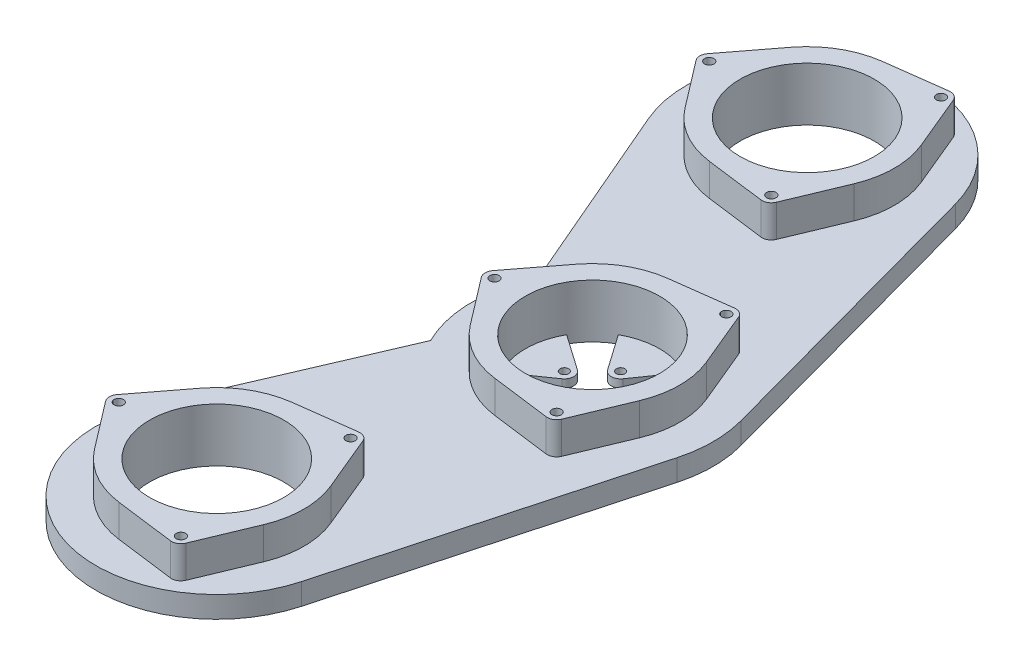
from build123d import *

# Parameters (mm, degrees)
SALIENTE_EXTRUIR1_DEPTH    = 8
SALIENTE_EXTRUIR2_DEPTH    = 12
CORTAR_EXTRUIR3_DEPTH      = 173.609385608
CORTAR_EXTRUIR3_DEPTH_BACK = 173.609385608
CROQUIS7_R                 = 25
CROQUIS7_R_2               = 1.75
SALIENTE_EXTRUIR4_START    = -3
SALIENTE_EXTRUIR4_DEPTH    = 3
CROQUIS10_R                = 1.6
CORTAR_EXTRUIR4_DEPTH      = 173.609385608


with BuildPart() as part:
    # Croquis1 → Saliente-Extruir1 (new body)
    with BuildSketch(Plane(origin=(0, 0, 0), x_dir=(1, 0, 0), z_dir=(0, 1, 0))):
        with BuildLine():
            Line((-71.345800689, 92.236983213), (-40.311288741, 20))
            ThreePointArc((-40.311288741, 20), (-45, 0), (-40.311288741, -20))
            Line((-40.311288741, -20), (-71.345800689, -92.236983213))
            ThreePointArc((-71.345800689, -92.236983213), (-44.837742086, -152.483425118), (13.414371956, -121.840283261))
            Line((13.414371956, -121.840283261), (43.414371956, -11.840283261))
            ThreePointArc((43.414371956, -11.840283261), (45, 0), (43.414371956, 11.840283261))
            Line((43.414371956, 11.840283261), (13.414371956, 121.840283261))
            ThreePointArc((13.414371956, 121.840283261), (-44.837742086, 152.483425118), (-71.345800689, 92.236983213))
        make_face()
    extrude(amount=SALIENTE_EXTRUIR1_DEPTH)

    # Croquis6 → Saliente-Extruir2 (add)
    with BuildSketch(Plane(origin=(0, 8, 0), x_dir=(1, 0, 0), z_dir=(0, 1, 0))):
        with BuildLine():
            Line((-39.280821918, 2.125330436), (-25.821917808, 19.73521119))
            ThreePointArc((-25.821917808, 19.73521119), (-16.25, 28.145825623), (-4.180235335, 32.230042391))
            Line((-4.180235335, 32.230042391), (17.79982081, 35.08085488))
            ThreePointArc((17.79982081, 35.08085488), (20, 34.641016151), (21.481001108, 32.955524444))
            Line((21.481001108, 32.955524444), (30.002153144, 12.494831201))
            ThreePointArc((30.002153144, 12.494831201), (32.5, 0), (30.002153144, -12.494831201))
            Line((30.002153144, -12.494831201), (21.481001108, -32.955524444))
            ThreePointArc((21.481001108, -32.955524444), (20, -34.641016151), (17.79982081, -35.08085488))
            Line((17.79982081, -35.08085488), (-4.180235335, -32.230042391))
            ThreePointArc((-4.180235335, -32.230042391), (-16.25, -28.145825623), (-25.821917808, -19.73521119))
            Line((-25.821917808, -19.73521119), (-39.280821918, -2.125330436))
            ThreePointArc((-39.280821918, -2.125330436), (-40, 0), (-39.280821918, 2.125330436))
        make_face()
        with BuildLine():
            Line((-69.280821918, -107.874669564), (-55.821917808, -90.26478881))
            ThreePointArc((-55.821917808, -90.26478881), (-46.25, -81.854174377), (-34.180235335, -77.769957609))
            Line((-34.180235335, -77.769957609), (-12.20017919, -74.91914512))
            ThreePointArc((-12.20017919, -74.91914512), (-10, -75.358983849), (-8.518998892, -77.044475556))
            Line((-8.518998892, -77.044475556), (0.002153144, -97.505168799))
            ThreePointArc((0.002153144, -97.505168799), (2.5, -110), (0.002153144, -122.494831201))
            Line((0.002153144, -122.494831201), (-8.518998892, -142.955524444))
            ThreePointArc((-8.518998892, -142.955524444), (-10, -144.641016151), (-12.20017919, -145.08085488))
            Line((-12.20017919, -145.08085488), (-34.180235335, -142.230042391))
            ThreePointArc((-34.180235335, -142.230042391), (-46.25, -138.145825623), (-55.821917808, -129.73521119))
            Line((-55.821917808, -129.73521119), (-69.280821918, -112.125330436))
            ThreePointArc((-69.280821918, -112.125330436), (-70, -110), (-69.280821918, -107.874669564))
        make_face()
        with BuildLine():
            Line((-69.280821918, 107.874669564), (-55.821917808, 90.26478881))
            ThreePointArc((-55.821917808, 90.26478881), (-46.25, 81.854174377), (-34.180235335, 77.769957609))
            Line((-34.180235335, 77.769957609), (-12.20017919, 74.91914512))
            ThreePointArc((-12.20017919, 74.91914512), (-10, 75.358983849), (-8.518998892, 77.044475556))
            Line((-8.518998892, 77.044475556), (0.002153144, 97.505168799))
            ThreePointArc((0.002153144, 97.505168799), (2.5, 110), (0.002153144, 122.494831201))
            Line((0.002153144, 122.494831201), (-8.518998892, 142.955524444))
            ThreePointArc((-8.518998892, 142.955524444), (-10, 144.641016151), (-12.20017919, 145.08085488))
            Line((-12.20017919, 145.08085488), (-34.180235335, 142.230042391))
            ThreePointArc((-34.180235335, 142.230042391), (-46.25, 138.145825623), (-55.821917808, 129.73521119))
            Line((-55.821917808, 129.73521119), (-69.280821918, 112.125330436))
            ThreePointArc((-69.280821918, 112.125330436), (-70, 110), (-69.280821918, 107.874669564))
        make_face()
    extrude(amount=SALIENTE_EXTRUIR2_DEPTH)

    # Croquis7 → Cortar-Extruir3 (cut, two sides: drawn at the far end of the back side and taken through both)
    with BuildSketch(Plane(origin=(0, 8, 0), x_dir=(1, 0, 0), z_dir=(0, 1, 0)).offset(-CORTAR_EXTRUIR3_DEPTH_BACK)):
        with Locations(Location((0, 0, 0), (0, 0, 270))):
            Circle(CROQUIS7_R)
        with Locations(Location((-30, 110, 0), (0, 0, 270))):
            Circle(CROQUIS7_R)
        with Locations(Location((-30, -110, 0), (0, 0, 270))):
            Circle(CROQUIS7_R)
        with Locations(Location((-36.5, 0, 0), (0, 0, 270))):
            Circle(CROQUIS7_R_2)
        with Locations(Location((18.25, -31.609927238, 0), (0, 0, 270))):
            Circle(CROQUIS7_R_2)
        with Locations(Location((18.25, 31.609927238, 0), (0, 0, 270))):
            Circle(CROQUIS7_R_2)
        with Locations(Location((-11.75, 141.609927238, 0), (0, 0, 270))):
            Circle(CROQUIS7_R_2)
        with Locations(Location((-66.5, 110, 0), (0, 0, 270))):
            Circle(CROQUIS7_R_2)
        with Locations(Location((-11.75, 78.390072762, 0), (0, 0, 270))):
            Circle(CROQUIS7_R_2)
        with Locations(Location((-66.5, -110, 0), (0, 0, 270))):
            Circle(CROQUIS7_R_2)
        with Locations(Location((-11.75, -141.609927238, 0), (0, 0, 270))):
            Circle(CROQUIS7_R_2)
        with Locations(Location((-11.75, -78.390072762, 0), (0, 0, 270))):
            Circle(CROQUIS7_R_2)
    extrude(amount=CORTAR_EXTRUIR3_DEPTH + CORTAR_EXTRUIR3_DEPTH_BACK, mode=Mode.SUBTRACT)

    # Croquis9 → Saliente-Extruir4 (add)
    with BuildSketch(Plane.XZ.offset(SALIENTE_EXTRUIR4_START)):
        with BuildLine():
            Line((-2.867032155, 8.492482473), (-12.199873602, 21.821161383))
            ThreePointArc((-12.199873602, 21.821161383), (0, 25), (12.199873602, 21.821161383))
            Line((12.199873602, 21.821161383), (2.867032155, 8.492482473))
            ThreePointArc((2.867032155, 8.492482473), (0, 7), (-2.867032155, 8.492482473))
        make_face()
        with BuildLine():
            Line((8.492482473, 2.867032155), (21.821161383, 12.199873602))
            ThreePointArc((21.821161383, 12.199873602), (25, 0), (21.821161383, -12.199873602))
            Line((21.821161383, -12.199873602), (8.492482473, -2.867032155))
            ThreePointArc((8.492482473, -2.867032155), (7, 0), (8.492482473, 2.867032155))
        make_face()
        with BuildLine():
            Line((2.867032155, -8.492482473), (12.199873602, -21.821161383))
            ThreePointArc((12.199873602, -21.821161383), (0, -25), (-12.199873602, -21.821161383))
            Line((-12.199873602, -21.821161383), (-2.867032155, -8.492482473))
            ThreePointArc((-2.867032155, -8.492482473), (0, -7), (2.867032155, -8.492482473))
        make_face()
        with BuildLine():
            Line((-8.492482473, -2.867032155), (-21.821161383, -12.199873602))
            ThreePointArc((-21.821161383, -12.199873602), (-25, 0), (-21.821161383, 12.199873602))
            Line((-21.821161383, 12.199873602), (-8.492482473, 2.867032155))
            ThreePointArc((-8.492482473, 2.867032155), (-7, 0), (-8.492482473, -2.867032155))
        make_face()
    extrude(amount=SALIENTE_EXTRUIR4_DEPTH)

    # Croquis10 → Cortar-Extruir4 (cut, through all)
    with BuildSketch(Plane(origin=(0, 8, 0), x_dir=(1, 0, 0), z_dir=(0, 1, 0))):
        with Locations(Location((-10.5, 0, 0), (0, 0, 270))):
            Circle(CROQUIS10_R)
        with Locations(Location((0, -10.5, 0), (0, 0, 270))):
            Circle(CROQUIS10_R)
        with Locations(Location((10.5, 0, 0), (0, 0, 270))):
            Circle(CROQUIS10_R)
        with Locations(Location((0, 10.5, 0), (0, 0, 270))):
            Circle(CROQUIS10_R)
    extrude(amount=-CORTAR_EXTRUIR4_DEPTH, mode=Mode.SUBTRACT)


solid = part.part
